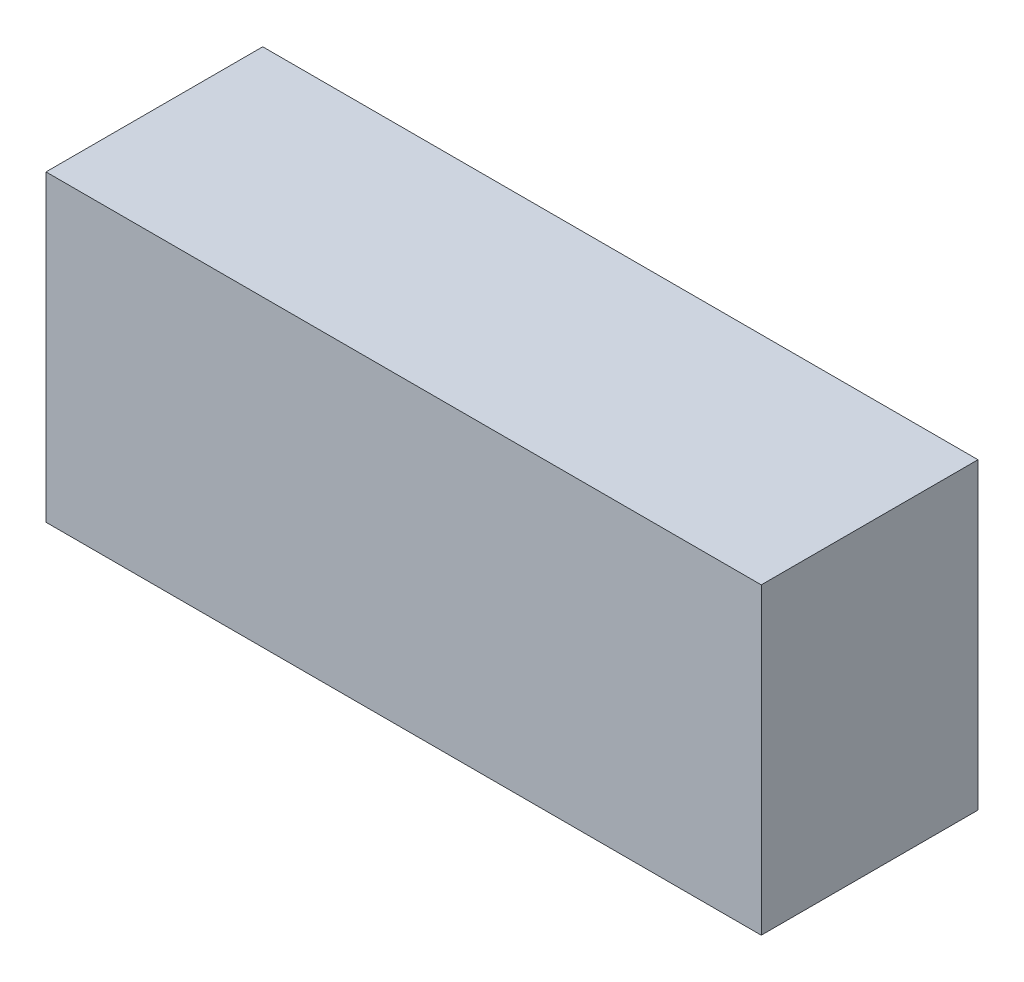
from build123d import *

# Parameters (mm, degrees)
SKETCH_1_W      = 165
SKETCH_1_H      = 70
EXTRUDE_1_DEPTH = 50


with BuildPart() as part:
    # 草图1 → 凸台-拉伸1 (new body)
    with BuildSketch(Plane.XY):
        Rectangle(SKETCH_1_W, SKETCH_1_H)
    extrude(amount=EXTRUDE_1_DEPTH)


solid = part.part
